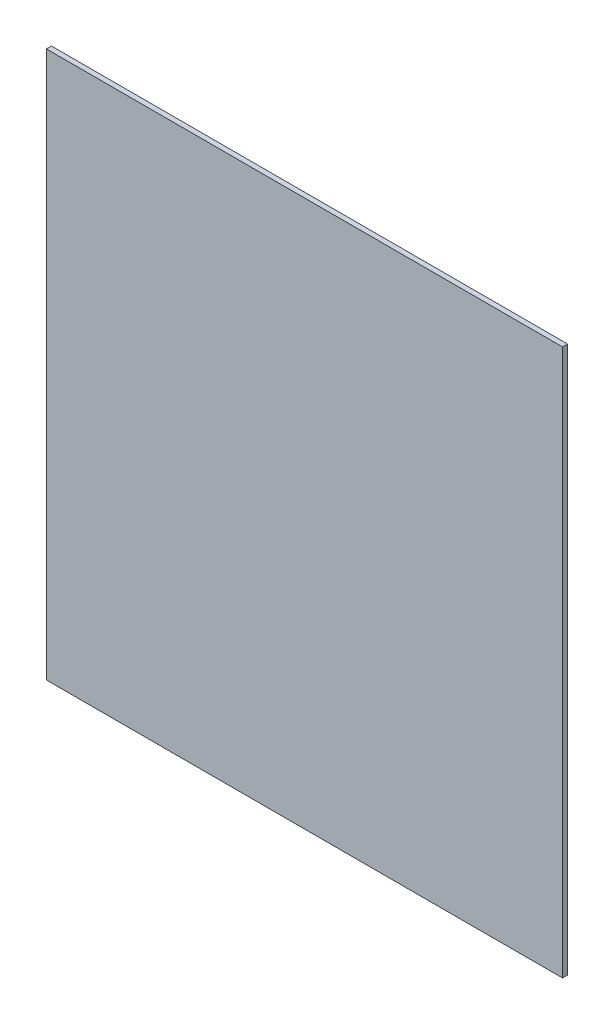
from build123d import *

# Parameters (mm, degrees)
SKETCH_1_W      = 612
SKETCH_1_H      = 648
EXTRUDE_1_DEPTH = 6


with BuildPart() as part:
    # Эскиз1 → Бобышка-Вытянуть1 (new body)
    with BuildSketch(Plane.XY):
        with Locations((300, 324)):
            Rectangle(SKETCH_1_W, SKETCH_1_H)
    extrude(amount=EXTRUDE_1_DEPTH)


solid = part.part
